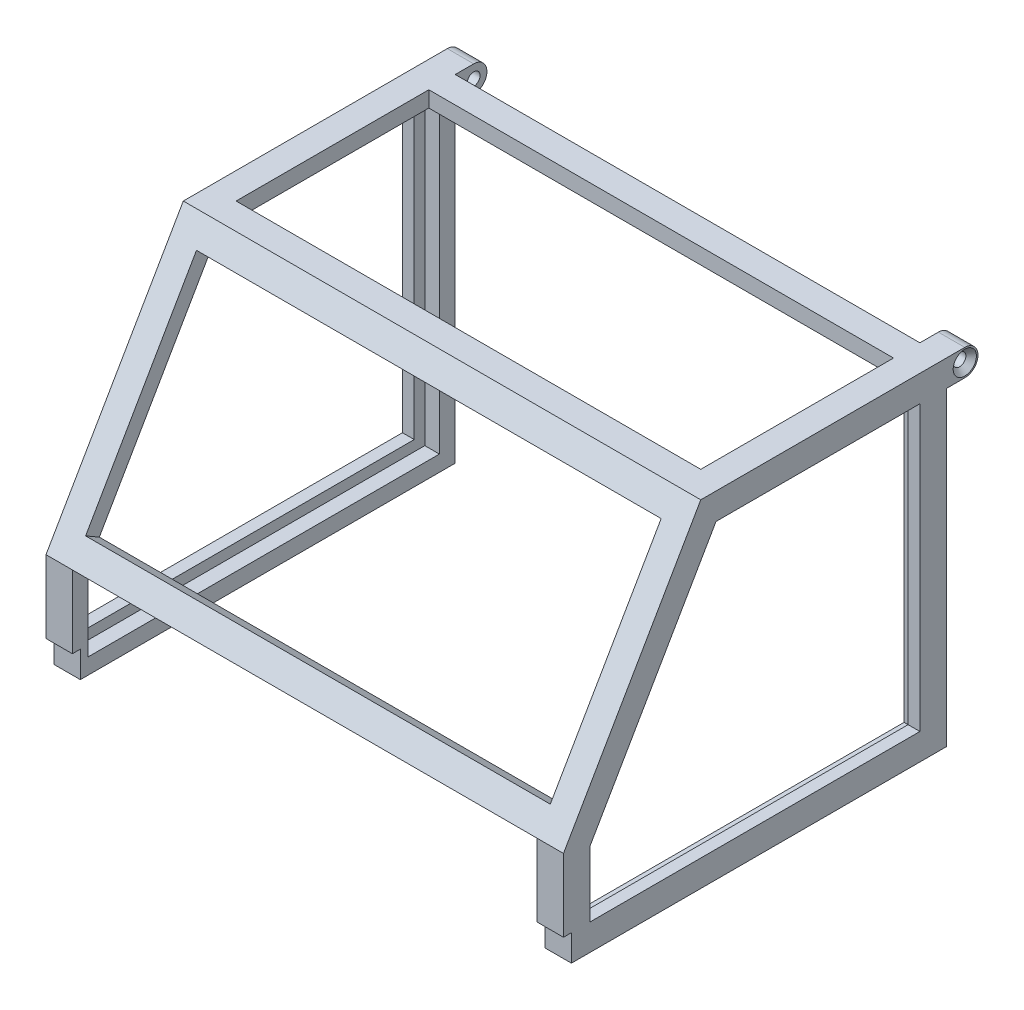
from build123d import *

# Parameters (mm, degrees)
BOSS_EXTRUDE1_DEPTH                             = 5
CSK_FOR_M2_OVAL_HEAD_MACHINE_SCREW1_D           = 2.4
CSK_FOR_M2_OVAL_HEAD_MACHINE_SCREW1_CSINK_D     = 4.4
CSK_FOR_M2_OVAL_HEAD_MACHINE_SCREW1_CSINK_ANGLE = 90
CUT_EXTRUDE1_DEPTH                              = 2.762
SKETCH9_W                                       = 5
SKETCH9_H                                       = 5
CUT_EXTRUDE3_DEPTH                              = 1.5
BOSS_EXTRUDE2_DEPTH                             = 44
BOSS_EXTRUDE5_START                             = 2.76
BOSS_EXTRUDE5_DEPTH                             = 44.5


with BuildPart() as part:
    # Sketch1 → Boss-Extrude1 (new body)
    with BuildSketch(Plane(origin=(0, 0, 0), x_dir=(0, 0, -1), z_dir=(1, 0, 0))):
        with BuildLine():
            Line((-36.25, 0.243748214), (36.25, 0.243748214))
            Line((36.25, 0.243748214), (36.25, 58.993748214))
            Line((36.25, 58.993748214), (39.75, 58.993748214))
            ThreePointArc((39.75, 58.993748214), (42.25, 61.493748214), (39.75, 63.993748214))
            Line((39.75, 63.993748214), (36.25, 63.993748214))
            Line((36.25, 63.993748214), (-10.25, 63.993748214))
            Line((-10.25, 63.993748214), (-36.25, 18.993748214))
            Line((-36.25, 18.993748214), (-36.25, 0.243748214))
        make_face()
        Polygon((31.25, 5.243748214), (-31.25, 5.243748214), (-31.25, 17.653143244), (-18.920674634, 38.992360224), (-7.364317129, 58.993748214), (31.25, 58.993748214), align=None, mode=Mode.SUBTRACT)
    extrude(amount=BOSS_EXTRUDE1_DEPTH)

    # CSK for M2 Oval Head Machine Screw1 (through all)
    with Locations(Plane.ZY):
        with Locations((-39.75, 61.493748214)):
            CounterSinkHole(CSK_FOR_M2_OVAL_HEAD_MACHINE_SCREW1_D / 2, CSK_FOR_M2_OVAL_HEAD_MACHINE_SCREW1_CSINK_D / 2, counter_sink_angle=CSK_FOR_M2_OVAL_HEAD_MACHINE_SCREW1_CSINK_ANGLE)

    # Sketch6 → Cut-Extrude1 (cut)
    with BuildSketch(Plane(origin=(5, 0, 0), x_dir=(0, 0, -1), z_dir=(1, 0, 0))):
        Polygon((33.25, 60.993748214), (33.25, 3.243748214), (-33.25, 3.243748214), (-33.25, 18.189385232), (-8.518590277, 60.993748214), align=None)
    extrude(amount=-CUT_EXTRUDE1_DEPTH, mode=Mode.SUBTRACT)

    # Sketch9 → Cut-Extrude3 (cut)
    with BuildSketch(Plane.XY.offset(36.25)):
        with Locations((2.5, 2.743748214)):
            Rectangle(SKETCH9_W, SKETCH9_H)
    extrude(amount=-CUT_EXTRUDE3_DEPTH, mode=Mode.SUBTRACT)

    # Sketch10 → Boss-Extrude2 (add)
    with BuildSketch(Plane(origin=(5, 0, 0), x_dir=(0, 0, -1), z_dir=(1, 0, 0))):
        Polygon((-10.25, 63.993748214), (-5.25, 63.993748214), (-5.25, 60.993748214), (-8.518590277, 60.993748214), (-10.15379277, 58.163590054), (-12.751387989, 59.664422848), align=None)
        Polygon((36.25, 58.993748214), (36.25, 63.993748214), (31.25, 63.993748214), (31.25, 60.993748214), (33.25, 60.993748214), (33.25, 58.993748214), align=None)
        Polygon((-36.25, 18.993748214), (-33.748612011, 23.32307358), (-31.151016791, 21.822240786), (-32.785256944, 18.993748214), align=None)
    extrude(amount=BOSS_EXTRUDE2_DEPTH)

    # Sketch14 → Boss-Extrude5 (add)
    with BuildSketch(Plane(origin=(2.238, 0, 0), x_dir=(0, 0, -1), z_dir=(1, 0, 0)).offset(BOSS_EXTRUDE5_START)):
        Polygon((-32.785256944, 18.993748214), (-30.47542824, 18.993748214), (-29.973344698, 19.862738959), (-31.705074845, 20.863294155), align=None)
    extrude(amount=BOSS_EXTRUDE5_DEPTH)

    # Mirror1: part across plane


with BuildPart() as part_1:
    add(part.part)
    add(part.part.mirror(Plane(origin=(49, 0, 0), x_dir=(0, 0, 1), z_dir=(1, 0, 0))))


solid = part_1.part
